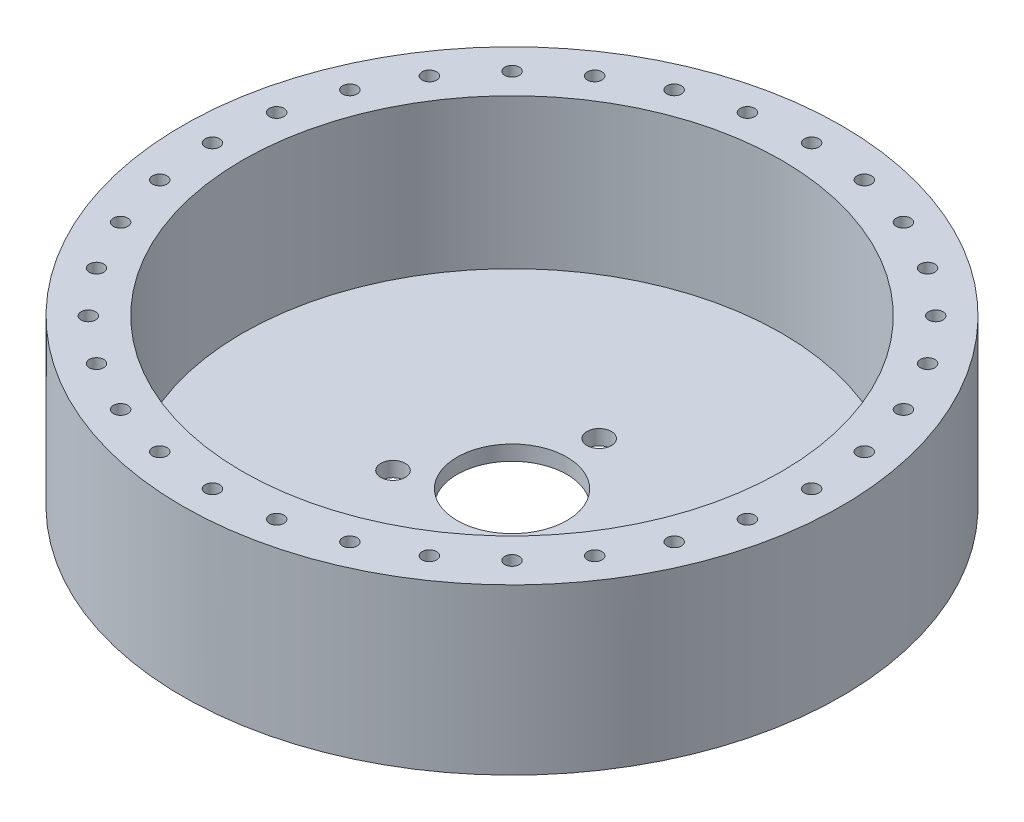
from build123d import *

# Parameters (mm, degrees)
SKETCH1_R           = 66
SKETCH1_R_2         = 54
BOSS_EXTRUDE1_DEPTH = 30
SKETCH2_R           = 1.45
CUT_EXTRUDE1_DEPTH  = 5
BOSS_EXTRUDE2_START = 3
SKETCH3_R           = 66
BOSS_EXTRUDE2_DEPTH = 3
SKETCH4_R           = 11
SKETCH4_R_2         = 2.45
CUT_EXTRUDE2_DEPTH  = 99.04080783


with BuildPart() as part:
    # Sketch1 → Boss-Extrude1 (new body)
    with BuildSketch(Plane(origin=(0, 0, 0), x_dir=(1, 0, 0), z_dir=(0, 1, 0))):
        with Locations(Location((0, 0, 0), (0, 0, 270))):
            Circle(SKETCH1_R)
        with Locations(Location((0, 0, 0), (0, 0, 270))):
            Circle(SKETCH1_R_2, mode=Mode.SUBTRACT)
    extrude(amount=BOSS_EXTRUDE1_DEPTH)

    # Sketch2 → Cut-Extrude1 (cut)
    with BuildSketch(Plane(origin=(0, 30, 0), x_dir=(1, 0, 0), z_dir=(0, 1, 0))):
        with Locations(Location((0, 60, 0), (0, 0, 270))):
            Circle(SKETCH2_R)
        with Locations(Location((11.705419321, 58.847116824, 0), (0, 0, 270))):
            Circle(SKETCH2_R)
        with Locations(Location((22.961005942, 55.432771951, 0), (0, 0, 270))):
            Circle(SKETCH2_R)
        with Locations(Location((33.334213981, 49.888176738, 0), (0, 0, 270))):
            Circle(SKETCH2_R)
        with Locations(Location((42.426406871, 42.426406871, 0), (0, 0, 270))):
            Circle(SKETCH2_R)
        with Locations(Location((49.888176738, 33.334213981, 0), (0, 0, 270))):
            Circle(SKETCH2_R)
        with Locations(Location((55.432771951, 22.961005942, 0), (0, 0, 270))):
            Circle(SKETCH2_R)
        with Locations(Location((58.847116824, 11.705419321, 0), (0, 0, 270))):
            Circle(SKETCH2_R)
        with Locations(Location((60, 0, 0), (0, 0, 270))):
            Circle(SKETCH2_R)
        with Locations(Location((58.847116824, -11.705419321, 0), (0, 0, 270))):
            Circle(SKETCH2_R)
        with Locations(Location((55.432771951, -22.961005942, 0), (0, 0, 270))):
            Circle(SKETCH2_R)
        with Locations(Location((49.888176738, -33.334213981, 0), (0, 0, 270))):
            Circle(SKETCH2_R)
        with Locations(Location((42.426406871, -42.426406871, 0), (0, 0, 270))):
            Circle(SKETCH2_R)
        with Locations(Location((33.334213981, -49.888176738, 0), (0, 0, 270))):
            Circle(SKETCH2_R)
        with Locations(Location((22.961005942, -55.432771951, 0), (0, 0, 270))):
            Circle(SKETCH2_R)
        with Locations(Location((11.705419321, -58.847116824, 0), (0, 0, 270))):
            Circle(SKETCH2_R)
        with Locations(Location((0, -60, 0), (0, 0, 270))):
            Circle(SKETCH2_R)
        with Locations(Location((-11.705419321, -58.847116824, 0), (0, 0, 270))):
            Circle(SKETCH2_R)
        with Locations(Location((-22.961005942, -55.432771951, 0), (0, 0, 270))):
            Circle(SKETCH2_R)
        with Locations(Location((-33.334213981, -49.888176738, 0), (0, 0, 270))):
            Circle(SKETCH2_R)
        with Locations(Location((-42.426406871, -42.426406871, 0), (0, 0, 270))):
            Circle(SKETCH2_R)
        with Locations(Location((-49.888176738, -33.334213981, 0), (0, 0, 270))):
            Circle(SKETCH2_R)
        with Locations(Location((-55.432771951, -22.961005942, 0), (0, 0, 270))):
            Circle(SKETCH2_R)
        with Locations(Location((-58.847116824, -11.705419321, 0), (0, 0, 270))):
            Circle(SKETCH2_R)
        with Locations(Location((-60, 0, 0), (0, 0, 270))):
            Circle(SKETCH2_R)
        with Locations(Location((-58.847116824, 11.705419321, 0), (0, 0, 270))):
            Circle(SKETCH2_R)
        with Locations(Location((-55.432771951, 22.961005942, 0), (0, 0, 270))):
            Circle(SKETCH2_R)
        with Locations(Location((-49.888176738, 33.334213981, 0), (0, 0, 270))):
            Circle(SKETCH2_R)
        with Locations(Location((-42.426406871, 42.426406871, 0), (0, 0, 270))):
            Circle(SKETCH2_R)
        with Locations(Location((-33.334213981, 49.888176738, 0), (0, 0, 270))):
            Circle(SKETCH2_R)
        with Locations(Location((-22.961005942, 55.432771951, 0), (0, 0, 270))):
            Circle(SKETCH2_R)
        with Locations(Location((-11.705419321, 58.847116824, 0), (0, 0, 270))):
            Circle(SKETCH2_R)
    extrude(amount=-CUT_EXTRUDE1_DEPTH, mode=Mode.SUBTRACT)

    # Sketch3 → Boss-Extrude2 (add)
    with BuildSketch(Plane.XZ.offset(BOSS_EXTRUDE2_START)):
        with Locations(Location((0, 0, 0), (0, 0, 270))):
            Circle(SKETCH3_R)
    extrude(amount=-BOSS_EXTRUDE2_DEPTH)

    # Sketch4 → Cut-Extrude2 (cut, through all)
    with BuildSketch(Plane(origin=(0, 0, 0), x_dir=(1, 0, 0), z_dir=(0, 1, 0))):
        with Locations(Location((0, 0, 0), (0, 0, 270))):
            Circle(SKETCH4_R)
        with Locations(Location((0, 17.45, 0), (0, 0, 270))):
            Circle(SKETCH4_R_2)
        with Locations(Location((-15.112143296, -8.725, 0), (0, 0, 270))):
            Circle(SKETCH4_R_2)
        with Locations(Location((15.112143296, -8.725, 0), (0, 0, 270))):
            Circle(SKETCH4_R_2)
    extrude(amount=-CUT_EXTRUDE2_DEPTH, mode=Mode.SUBTRACT)


solid = part.part
